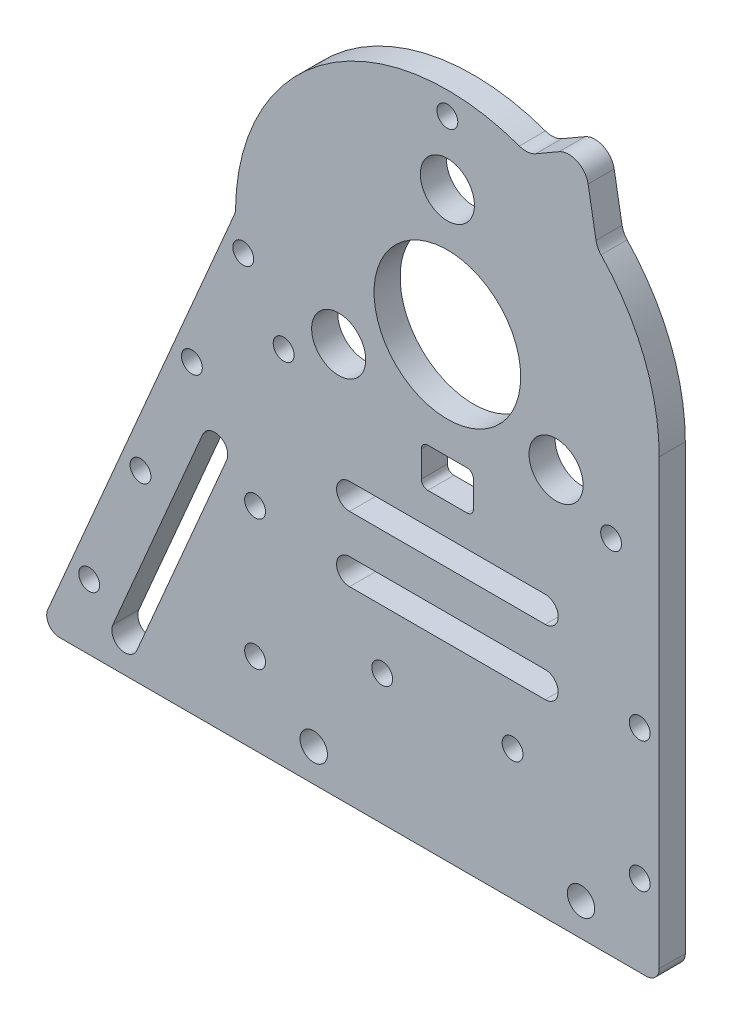
from build123d import *

# Parameters (mm, degrees)
SKETCH_1_R          = 32.5
SKETCH_1_R_2        = 11.25
EXTRUDE_1_DEPTH     = 4
EXTRUDE_START       = -4
EXTRUDE_2_DEPTH     = 4
SKETCH_3_R          = 4.15
CUT_EXTRUDE_1_DEPTH = 4
SKETCH_4_R          = 1.6
CUT_EXTRUDE_2_DEPTH = 4
SKETCH_5_W          = 17.6
SKETCH_5_H          = 4
EXTRUDE_3_DEPTH     = 4
SKETCH_6_R          = 2.1
CUT_EXTRUDE_3_DEPTH = 4
SKETCH_7_W          = 8
SKETCH_7_H          = 6
CUT_EXTRUDE_4_DEPTH = 4
FILLET_1_R          = 1
SKETCH_8_R          = 1.6
CUT_EXTRUDE_5_DEPTH = 10
SKETCH_9_W          = 35.2
SKETCH_9_H          = 4
CUT_EXTRUDE_6_DEPTH = 10
SKETCH_10_R         = 1.6
CUT_EXTRUDE_7_DEPTH = 10
EXTRUDE_4_DEPTH     = 4
FILLET_2_R          = 3
CUT_EXTRUDE_8_DEPTH = 10
EXTRUDE_5_DEPTH     = 4
FILLET_3_R          = 2
SKETCH_14_R         = 1.6
CUT_EXTRUDE_9_DEPTH = 10


with BuildPart() as part:
    # 草图1 → 凸台-拉伸1 (new body)
    with BuildSketch(Plane.XY):
        Circle(SKETCH_1_R)
        Circle(SKETCH_1_R_2, mode=Mode.SUBTRACT)
    extrude(amount=EXTRUDE_1_DEPTH)

    # 草图2 → 凸台-拉伸2 (add)
    with BuildSketch(Plane.XY.offset(4).offset(EXTRUDE_START)):
        with BuildLine():
            Line((-32.5, 0), (-32.5, -70))
            Line((-32.5, -70), (32.5, -70))
            Line((32.5, -70), (32.5, 0))
            ThreePointArc((32.5, 0), (0, -32.5), (-32.5, 0))
        make_face()
    extrude(amount=EXTRUDE_2_DEPTH)

    # 草图3 → 切除-拉伸1 (cut)
    with BuildSketch(Plane.XY.offset(4)):
        with Locations((0, 19.25)):
            Circle(SKETCH_3_R)
        with Locations((16.670989023, -9.625)):
            Circle(SKETCH_3_R)
        with Locations((-16.670989023, -9.625)):
            Circle(SKETCH_3_R)
    extrude(amount=-CUT_EXTRUDE_1_DEPTH, mode=Mode.SUBTRACT)

    # 草图4 → 切除-拉伸2 (cut)
    with BuildSketch(Plane.XY.offset(4)):
        with Locations((0, 29)):
            Circle(SKETCH_4_R)
        with Locations((25.11473671, -14.5)):
            Circle(SKETCH_4_R)
        with Locations((-25.11473671, -14.5)):
            Circle(SKETCH_4_R)
    extrude(amount=-CUT_EXTRUDE_2_DEPTH, mode=Mode.SUBTRACT)

    # 草图5 → 凸台-拉伸3 (add)
    with BuildSketch(Plane.XY.offset(4)):
        with Locations((-8.8, -72)):
            Rectangle(SKETCH_5_W, SKETCH_5_H)
        with Locations((8.8, -72)):
            Rectangle(SKETCH_5_W, SKETCH_5_H)
    extrude(amount=-EXTRUDE_3_DEPTH)

    # 草图6 → 切除-拉伸3 (cut)
    with BuildSketch(Plane.XY.offset(4)):
        with Locations((-20.5, -65)):
            Circle(SKETCH_6_R)
        with Locations((20.5, -65)):
            Circle(SKETCH_6_R)
    extrude(amount=-CUT_EXTRUDE_3_DEPTH, mode=Mode.SUBTRACT)

    # 草图7 → 切除-拉伸4 (cut)
    with BuildSketch(Plane.XY.offset(4)):
        with Locations((0, -19.2)):
            Rectangle(SKETCH_7_W, SKETCH_7_H)
    extrude(amount=-CUT_EXTRUDE_4_DEPTH, mode=Mode.SUBTRACT)

    # 圆角1
    fillet_1_edges = [part.edges().sort_by_distance(p)[0] for p in [
        (4, -16.2, 2),
        (4, -22.2, 2),
        (-4, -22.2, 2),
        (-4, -16.2, 2),
    ]]
    fillet(fillet_1_edges, radius=FILLET_1_R)

    # 草图8 → 切除-拉伸5 (cut)
    with BuildSketch(Plane(origin=(0, 0, 0), x_dir=(-1, 0, 0), z_dir=(0, 0, -1))):
        with Locations((-10, -50)):
            Circle(SKETCH_8_R)
        with Locations(Location((10, -50, 0), (0, 0, 180))):
            Circle(SKETCH_8_R)
    extrude(amount=-CUT_EXTRUDE_5_DEPTH, mode=Mode.SUBTRACT)

    # 草图9 → 切除-拉伸6 (cut)
    with BuildSketch(Plane.XY.offset(4)):
        with Locations((0, -72)):
            Rectangle(SKETCH_9_W, SKETCH_9_H)
    extrude(amount=-CUT_EXTRUDE_6_DEPTH, mode=Mode.SUBTRACT)

    # 草图10 → 切除-拉伸7 (cut)
    with BuildSketch(Plane.XY.offset(4)):
        with Locations((-29.5, -57.5)):
            Circle(SKETCH_10_R)
        with Locations((-29.5, -37.5)):
            Circle(SKETCH_10_R)
        with Locations((29.5, -37.5)):
            Circle(SKETCH_10_R)
        with Locations((29.5, -57.5)):
            Circle(SKETCH_10_R)
    extrude(amount=-CUT_EXTRUDE_7_DEPTH, mode=Mode.SUBTRACT)

    # 草图11 → 凸台-拉伸4 (add)
    with BuildSketch(Plane.XY.offset(4).offset(EXTRUDE_START)):
        with BuildLine():
            Line((12.316815341, 30.075672226), (20.846001238, 35))
            Line((20.846001238, 35), (22.961925006, 23))
            ThreePointArc((22.961925006, 23), (17.990654921, 27.06633214), (12.316815341, 30.075672226))
        make_face()
    extrude(amount=EXTRUDE_4_DEPTH)

    # 圆角2
    fillet_2_edges = [part.edges().sort_by_distance(p)[0] for p in [
        (22.961925006, 23, 2),
        (12.316815341, 30.075672226, 2),
        (20.846001238, 35, 2),
    ]]
    fillet(fillet_2_edges, radius=FILLET_2_R)

    # 草图12 → 切除-拉伸8 (cut)
    with BuildSketch(Plane.XY.offset(4)):
        with BuildLine():
            Line((-15, -27), (15, -27))
            ThreePointArc((15, -27), (17, -29), (15, -31))
            Line((15, -31), (-15, -31))
            ThreePointArc((-15, -31), (-17, -29), (-15, -27))
        make_face()
        with BuildLine():
            Line((-15, -37), (15, -37))
            ThreePointArc((15, -37), (17, -39), (15, -41))
            Line((15, -41), (-15, -41))
            ThreePointArc((-15, -41), (-17, -39), (-15, -37))
        make_face()
    extrude(amount=-CUT_EXTRUDE_8_DEPTH, mode=Mode.SUBTRACT)

    # 草图13 → 凸台-拉伸5 (add)
    with BuildSketch(Plane.XY.offset(4)):
        Polygon((-32.5, 0), (-62.5, -70), (-32.5, -70), align=None)
    extrude(amount=-EXTRUDE_5_DEPTH)

    # 圆角3
    fillet_3_edges = [part.edges().sort_by_distance(p)[0] for p in [
        (-32.5, 0, 2),
        (32.5, -70, 2),
        (-62.5, -70, 2),
    ]]
    fillet(fillet_3_edges, radius=FILLET_3_R)

    # 草图14 → 切除-拉伸9 (cut)
    with BuildSketch(Plane.XY.offset(4)):
        with Locations((-54.950382955, -60)):
            Circle(SKETCH_14_R)
        with Locations((-47.071996983, -41.6170994)):
            Circle(SKETCH_14_R)
        with Locations((-39.193611011, -23.234198799)):
            Circle(SKETCH_14_R)
        with Locations((-31.31522504, -4.851298199)):
            Circle(SKETCH_14_R)
        with BuildLine():
            Line((-33.852001481, -33.617762547), (-47.639176932, -65.787838597))
            ThreePointArc((-47.639176932, -65.787838597), (-50.265305589, -66.83829006), (-51.315757052, -64.212161403))
            Line((-51.315757052, -64.212161403), (-37.528581601, -32.042085352))
            ThreePointArc((-37.528581601, -32.042085352), (-34.902452944, -30.991633889), (-33.852001481, -33.617762547))
        make_face()
    extrude(amount=-CUT_EXTRUDE_9_DEPTH, mode=Mode.SUBTRACT)


solid = part.part
